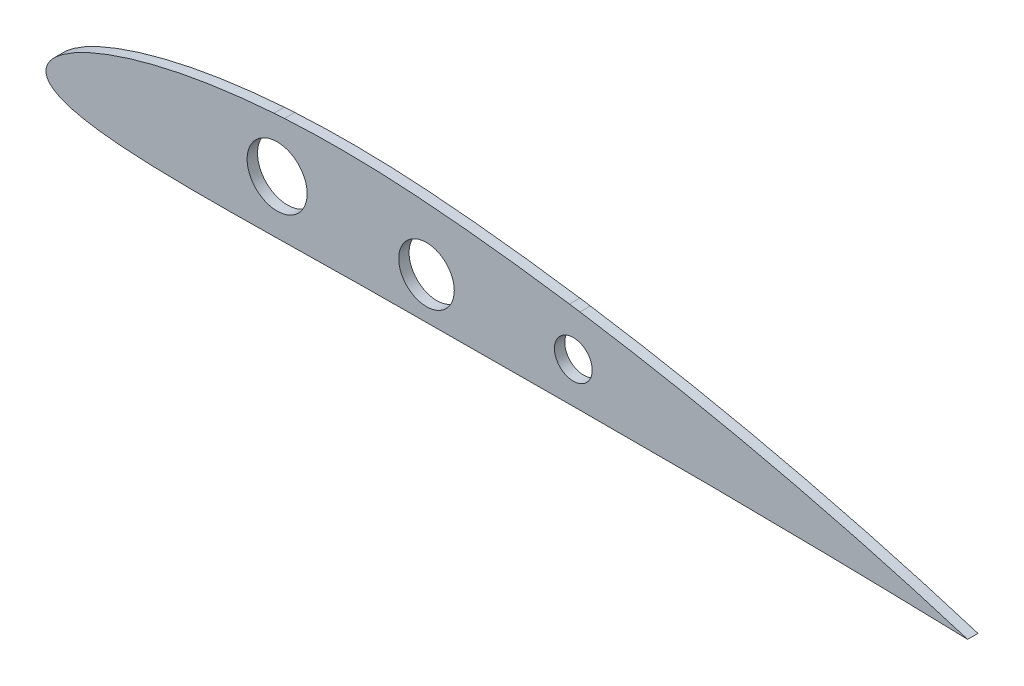
from build123d import *

# Parameters (mm, degrees)
SKETCH_1_R      = 5.1
SKETCH_1_R_2    = 7.5
SKETCH_1_R_3    = 8.1
EXTRUDE_1_DEPTH = 1.4


with BuildPart() as part:
    # Эскиз1 → Бобышка-Вытянуть1 (new, symmetric)
    with BuildSketch(Plane.XY):
        with BuildLine():
            Line((150.666396798, 129.82962039), (147.830444309, 130.255907631))
            add(Edge.make_bspline(
                [(147.830444309, 130.255907631), (141.461413304, 131.198524366), (128.693359955, 132.886388705), (112.67043132, 134.461645249), (99.826968741, 135.315000175), (86.964020356, 135.731264376), (77.308341909, 135.549477481), (70.887732655, 135.171040436)],
                knots=[0.429725304, 0.429725304, 0.429725304, 0.429725304, 0.50454493, 0.579364556, 0.61677437, 0.654184183, 0.729003809, 0.729003809, 0.729003809, 0.729003809], degree=3))
            Line((70.887732655, 135.171040436), (68.034324351, 134.985663537))
            add(Edge.make_bspline(
                [(68.034324351, 134.985663537), (62.466327292, 134.590052619), (54.128766773, 133.70015523), (43.125220573, 131.802909904), (34.953776148, 129.977054104), (26.907191476, 127.675989274), (20.367980904, 125.262128549), (15.336549935, 122.888373263), (11.739560791, 120.808049659), (8.991532459, 118.696410574), (7.481749343, 116.886227925), (6.915411804, 115.858161553), (6.707897041, 115.274334726), (6.625457542, 114.936901915), (6.585428501, 114.77290226)],
                knots=[0.740090669, 0.740090669, 0.740090669, 0.740090669, 0.805048089, 0.837526799, 0.870005509, 0.902484219, 0.934962929, 0.951202284, 0.967441639, 0.983680994, 0.991800672, 0.99586051, 0.99789043, 0.999920349, 0.999920349, 0.999920349, 0.999920349], degree=3))
            add(Edge.make_bspline(
                [(6.585428501, 114.77290226), (6.563664146, 114.614273348), (6.519009347, 114.285406452), (6.51479073, 113.71087901), (6.741898783, 112.661535219), (7.660184293, 111.409854013), (9.25908473, 110.308268876), (11.044608157, 109.487380203), (12.922194441, 108.850067694), (15.490126457, 108.172753601), (18.768502962, 107.558568007), (22.745443376, 107.043168294), (28.077313003, 106.557350362), (34.7695904, 106.213470375), (42.813490811, 106.037235573), (50.86267748, 106.006056339), (58.913615572, 106.062256394), (64.282042193, 106.132538161), (66.96601172, 106.171159397)],
                knots=[8.1168e-05, 8.1168e-05, 8.1168e-05, 8.1168e-05, 0.0020673, 0.004053433, 0.008025699, 0.015970231, 0.023914763, 0.031859294, 0.039803826, 0.047748358, 0.063637421, 0.079526485, 0.095415548, 0.127193675, 0.158971802, 0.190749929, 0.222528056, 0.254306183, 0.254306183, 0.254306183, 0.254306183], degree=3))
            Line((66.96601172, 106.171159397), (69.819069007, 106.21341025))
            add(Edge.make_bspline(
                [(69.819069007, 106.21341025), (76.253856733, 106.311006841), (85.904794849, 106.472137373), (98.777945674, 106.610759512), (111.6511009, 106.649514986), (127.735402572, 106.732475133), (140.606952957, 106.813706415), (147.042263767, 106.84262009)],
                knots=[0.265565078, 0.265565078, 0.265565078, 0.265565078, 0.341733085, 0.379817088, 0.417901091, 0.494069098, 0.570237104, 0.570237104, 0.570237104, 0.570237104], degree=3))
            Line((147.042263767, 106.84262009), (149.894619256, 106.85475599))
            add(Edge.make_bspline(
                [(149.894619256, 106.85475599), (158.680275083, 106.889957075), (176.251614136, 106.916321205), (202.609661936, 106.730645333), (228.96468106, 106.292568252), (246.530526637, 105.8505877), (255.312881654, 105.606761115)],
                knots=[0.581490104, 0.581490104, 0.581490104, 0.581490104, 0.685469054, 0.789448004, 0.893426954, 0.997405904, 0.997405904, 0.997405904, 0.997405904], degree=3))
            add(Edge.make_bspline(
                [(255.312881654, 105.606761115), (246.756257413, 108.260896884), (229.544442337, 113.256971155), (203.470240893, 119.79978809), (177.1785709, 125.404416996), (159.522198848, 128.478032218), (150.666396798, 129.82962039)],
                knots=[0.00222758, 0.00222758, 0.00222758, 0.00222758, 0.106325046, 0.210422513, 0.31451998, 0.418617446, 0.418617446, 0.418617446, 0.418617446], degree=3))
        make_face()
        with Locations((148.868108764, 117.844985284)):
            Circle(SKETCH_1_R, mode=Mode.SUBTRACT)
        with Locations((109.232573951, 117.844985284)):
            Circle(SKETCH_1_R_2, mode=Mode.SUBTRACT)
        with Locations((68.916842603, 120.636945021)):
            Circle(SKETCH_1_R_3, mode=Mode.SUBTRACT)
    extrude(amount=EXTRUDE_1_DEPTH, both=True)


solid = part.part
